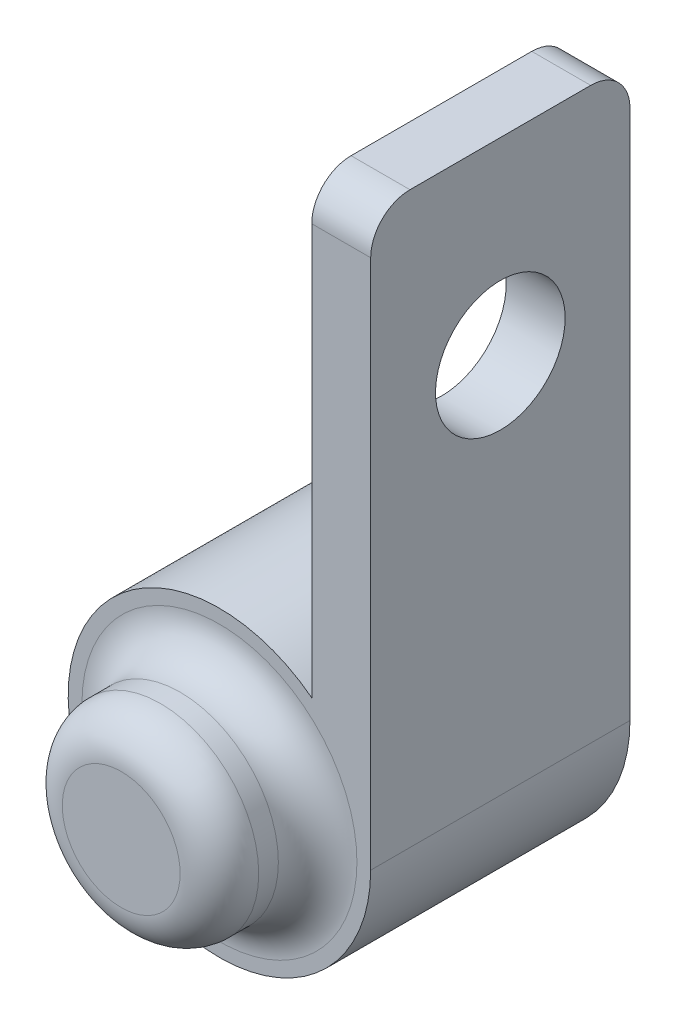
from build123d import *

# Parameters (mm, degrees)
SKETCH_1_R          = 3.85
EXTRUDE_1_DEPTH     = 6.6
EXTRUDE_START       = -6.6
EXTRUDE_2_DEPTH     = 6.6
SKETCH_3_R          = 2.5
EXTRUDE_3_DEPTH     = 2.5
FILLET_1_R          = 1
SKETCH_4_R          = 1.65
CUT_EXTRUDE_1_DEPTH = 10.6
FILLET_2_R          = 1


with BuildPart() as part:
    # 草图1 → 凸台-拉伸1 (new body)
    with BuildSketch(Plane.XY):
        Circle(SKETCH_1_R)
    extrude(amount=EXTRUDE_1_DEPTH)

    # 草图2 → 凸台-拉伸2 (add)
    with BuildSketch(Plane.XY.offset(6.6).offset(EXTRUDE_START)):
        with BuildLine():
            Line((3.85, 0), (3.85, 14.5))
            Line((3.85, 14.5), (2.35, 14.5))
            Line((2.35, 14.5), (2.35, 3.049590136))
            ThreePointArc((2.35, 3.049590136), (3.454706934, 1.699264547), (3.85, 0))
        make_face()
    extrude(amount=EXTRUDE_2_DEPTH)

    # 草图3 → 凸台-拉伸3 (add)
    with BuildSketch(Plane.XY.offset(6.6)):
        Circle(SKETCH_3_R)
    extrude(amount=EXTRUDE_3_DEPTH)

    # 圆角1
    fillet_1_edges = [part.edges().sort_by_distance(p)[0] for p in [
        (-2.5, 0, 6.6),
        (-2.5, 0, 9.1),
    ]]
    fillet(fillet_1_edges, radius=FILLET_1_R)

    # 草图4 → 切除-拉伸1 (cut)
    with BuildSketch(Plane.ZY.offset(-2.35)):
        with Locations(Location((3.3, 9.7, 0), (0, 0, 270))):
            Circle(SKETCH_4_R)
    extrude(amount=-CUT_EXTRUDE_1_DEPTH, mode=Mode.SUBTRACT)

    # 圆角2
    fillet_2_edges = [part.edges().sort_by_distance(p)[0] for p in [
        (3.1, 14.5, 6.6),
        (3.1, 14.5, 0),
    ]]
    fillet(fillet_2_edges, radius=FILLET_2_R)


solid = part.part
